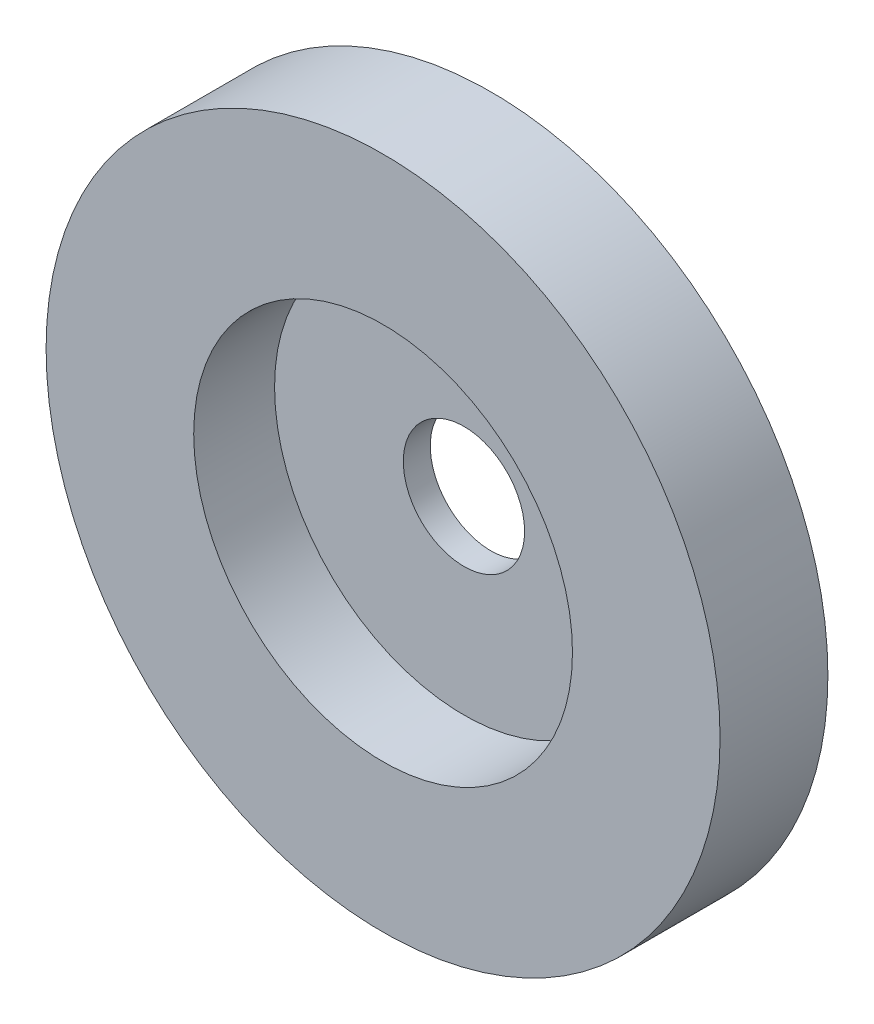
from build123d import *

# Parameters (mm, degrees)
SKETCH_1_R          = 25
EXTRUDE_1_DEPTH     = 8
SKETCH_7_R          = 14.05
CUT_EXTRUDE_6_DEPTH = 6
SKETCH_2_R          = 4.5
CUT_EXTRUDE_7_DEPTH = 11.5


with BuildPart() as part:
    # 草圖1 → 填料-伸長1 (new body)
    with BuildSketch(Plane.XY):
        Circle(SKETCH_1_R)
    extrude(amount=EXTRUDE_1_DEPTH)

    # 草圖7 → 除料-伸長6 (cut)
    with BuildSketch(Plane.XY.offset(8)):
        Circle(SKETCH_7_R)
    extrude(amount=-CUT_EXTRUDE_6_DEPTH, mode=Mode.SUBTRACT)

    # 草圖2 → 除料-伸長7 (cut)
    with BuildSketch(Plane.XY):
        Circle(SKETCH_2_R)
    extrude(amount=CUT_EXTRUDE_7_DEPTH, mode=Mode.SUBTRACT)


solid = part.part
